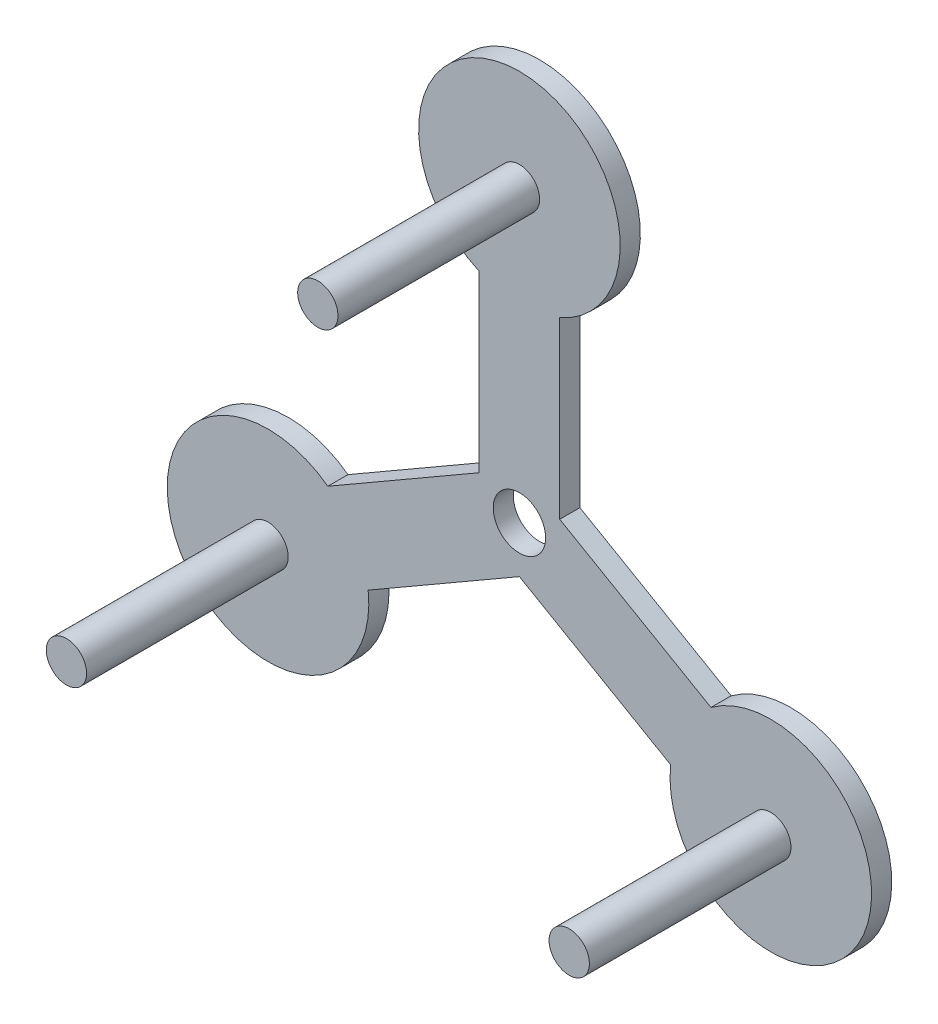
from build123d import *

# Parameters (mm, degrees)
BOSS_EXTRUDE2_DEPTH = 10
SKETCH3_R           = 50
BOSS_EXTRUDE3_DEPTH = 10
SKETCH4_R           = 10
BOSS_EXTRUDE4_DEPTH = 90
CUT_EXTRUDE1_START  = -30
SKETCH5_R           = 10
CUT_EXTRUDE1_DEPTH  = 30
SKETCH6_R           = 13
CUT_EXTRUDE2_DEPTH  = 10
SKETCH7_R           = 10
BOSS_EXTRUDE5_DEPTH = 30
SKETCH9_R           = 10
BOSS_EXTRUDE6_DEPTH = 10
SKETCH10_R          = 10
BOSS_EXTRUDE7_DEPTH = 10
SKETCH11_R          = 10
BOSS_EXTRUDE8_DEPTH = 10


with BuildPart() as part:
    # Sketch1 → Boss-Extrude2 (new body)
    with BuildSketch(Plane.XY):
        Polygon((20, 144), (-20, 144), (-20, 11.547005384), (-134.707658145, -54.679491924), (-114.707658145, -89.320508076), (0, -23.094010768), (114.707658145, -89.320508076), (134.707658145, -54.679491924), (20, 11.547005384), align=None)
    extrude(amount=BOSS_EXTRUDE2_DEPTH)

    # Sketch3 → Boss-Extrude3 (add)
    with BuildSketch(Plane.XY.offset(10)):
        with Locations((-124.707658145, -72)):
            Circle(SKETCH3_R)
        with Locations((0, 144)):
            Circle(SKETCH3_R)
        with Locations((124.707658145, -72)):
            Circle(SKETCH3_R)
    extrude(amount=-BOSS_EXTRUDE3_DEPTH)

    # Sketch4 → Boss-Extrude4 (add)
    with BuildSketch(Plane.XY.offset(10)):
        with Locations(Location((0, 144, 0), (0, 0, 180))):
            Circle(SKETCH4_R)
        with Locations(Location((124.707658145, -72, 0), (0, 0, 180))):
            Circle(SKETCH4_R)
        with Locations(Location((-124.707658145, -72, 0), (0, 0, 180))):
            Circle(SKETCH4_R)
    extrude(amount=BOSS_EXTRUDE4_DEPTH)

    # Sketch5 → Cut-Extrude1 (cut)
    with BuildSketch(Plane.XY.offset(100).offset(CUT_EXTRUDE1_START)):
        with Locations(Location((0, 144, 0), (0, 0, 180))):
            Circle(SKETCH5_R)
    extrude(amount=CUT_EXTRUDE1_DEPTH, mode=Mode.SUBTRACT)

    # Sketch6 → Cut-Extrude2 (cut)
    with BuildSketch(Plane.XY.offset(10)):
        Circle(SKETCH6_R)
    extrude(amount=-CUT_EXTRUDE2_DEPTH, mode=Mode.SUBTRACT)

    # Sketch7 → Boss-Extrude5 (add)
    with BuildSketch(Plane.XY.offset(70)):
        with Locations(Location((0, 144, 0), (0, 0, 180))):
            Circle(SKETCH7_R)
    extrude(amount=BOSS_EXTRUDE5_DEPTH)

    # Sketch9 → Boss-Extrude6 (add)
    with BuildSketch(Plane.XY.offset(100)):
        with Locations(Location((0, 144, 0), (0, 0, 180))):
            Circle(SKETCH9_R)
    extrude(amount=BOSS_EXTRUDE6_DEPTH)

    # Sketch10 → Boss-Extrude7 (add)
    with BuildSketch(Plane.XY.offset(100)):
        with Locations(Location((-124.707658145, -72, 0), (0, 0, 180))):
            Circle(SKETCH10_R)
    extrude(amount=BOSS_EXTRUDE7_DEPTH)

    # Sketch11 → Boss-Extrude8 (add)
    with BuildSketch(Plane.XY.offset(100)):
        with Locations(Location((124.707658145, -72, 0), (0, 0, 180))):
            Circle(SKETCH11_R)
    extrude(amount=BOSS_EXTRUDE8_DEPTH)


solid = part.part
